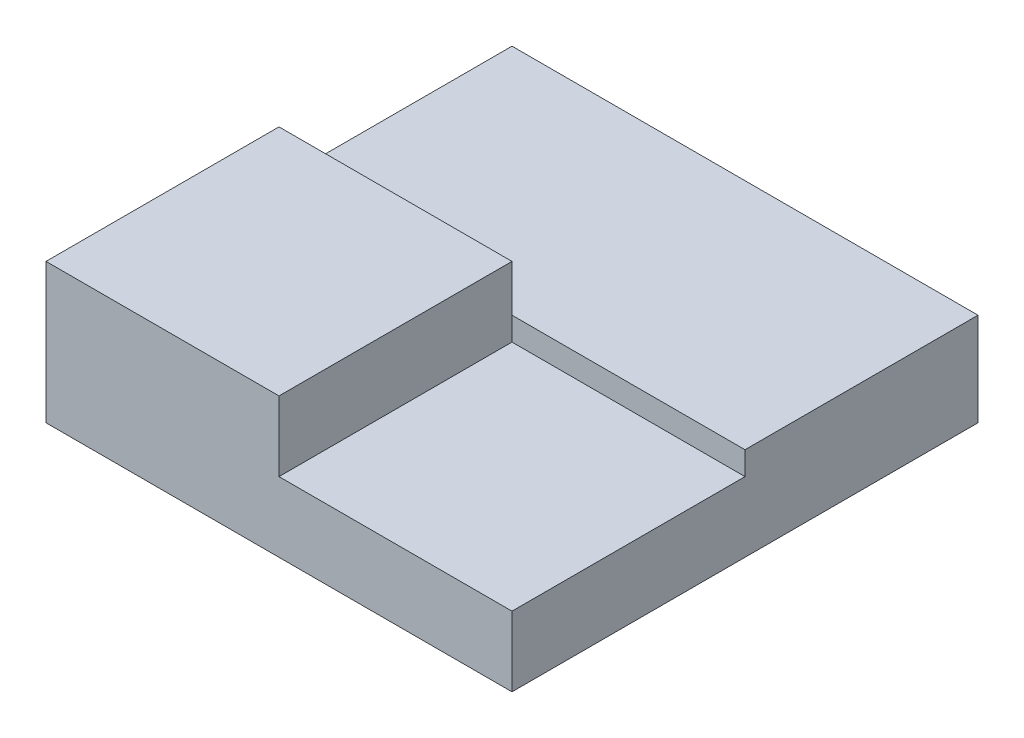
from build123d import *

# Parameters (mm, degrees)
SKETCH1_W           = 1
SKETCH1_H           = 1
BOSS_EXTRUDE1_DEPTH = 0.3
SKETCH2_W           = 1
SKETCH2_H           = 0.5
CUT_EXTRUDE1_DEPTH  = 0.1
SKETCH4_W           = 0.5
SKETCH4_H           = 0.5
CUT_EXTRUDE2_DEPTH  = 0.15


with BuildPart() as part:
    # Sketch1 → Boss-Extrude1 (new body)
    with BuildSketch(Plane(origin=(0, 0, 0), x_dir=(1, 0, 0), z_dir=(0, 1, 0))):
        Rectangle(SKETCH1_W, SKETCH1_H)
    extrude(amount=BOSS_EXTRUDE1_DEPTH)

    # Sketch2 → Cut-Extrude1 (cut)
    with BuildSketch(Plane(origin=(0, 0.3, 0), x_dir=(1, 0, 0), z_dir=(0, 1, 0))):
        with Locations((0, 0.25)):
            Rectangle(SKETCH2_W, SKETCH2_H)
    extrude(amount=-CUT_EXTRUDE1_DEPTH, mode=Mode.SUBTRACT)

    # Sketch4 → Cut-Extrude2 (cut)
    with BuildSketch(Plane(origin=(0, 0.3, 0), x_dir=(1, 0, 0), z_dir=(0, 1, 0))):
        with Locations((0.25, -0.25)):
            Rectangle(SKETCH4_W, SKETCH4_H)
    extrude(amount=-CUT_EXTRUDE2_DEPTH, mode=Mode.SUBTRACT)


solid = part.part
